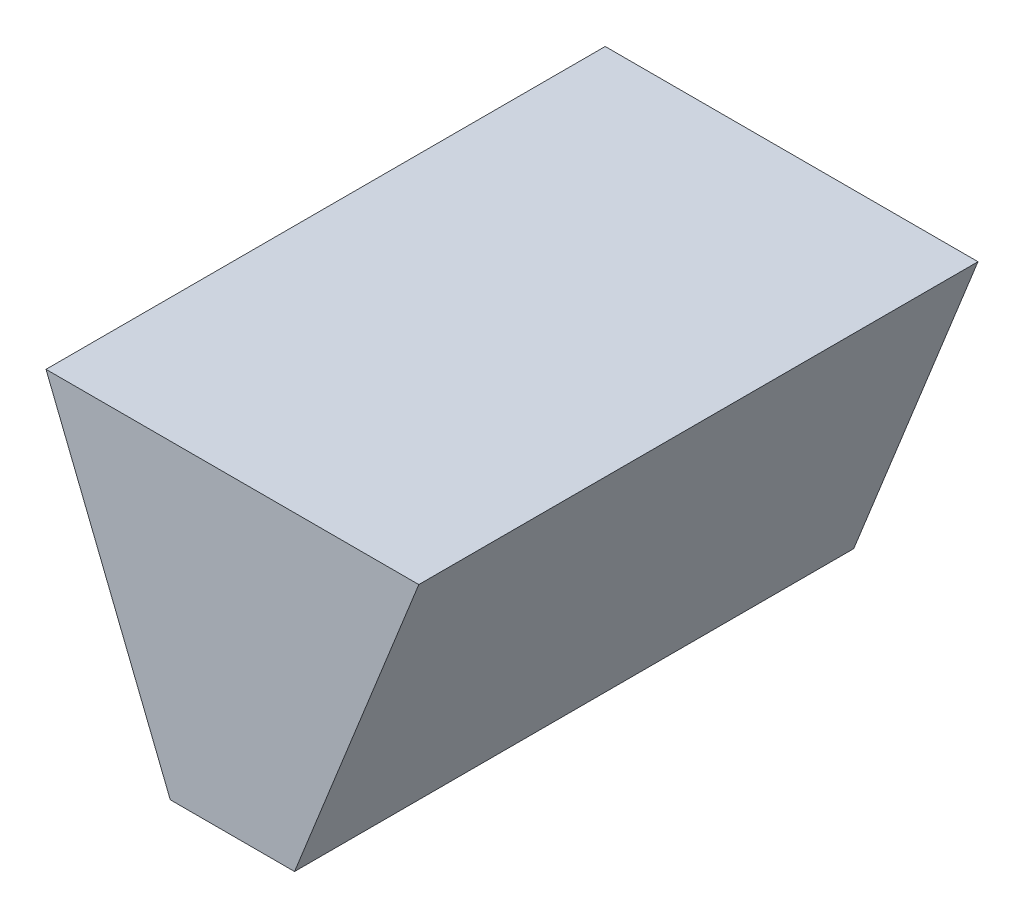
from build123d import *

# Parameters (mm, degrees)
BOSS_EXTRUDE1_DEPTH = 90


with BuildPart() as part:
    # Sketch1 → Boss-Extrude1 (new body)
    with BuildSketch(Plane.XY):
        Polygon((0, 0), (0, 50), (-30, 50), (-10, 0), align=None)
    extrude(amount=BOSS_EXTRUDE1_DEPTH)

    # Mirror1: part across plane


with BuildPart() as part_1:
    add(part.part)
    add(part.part.mirror(Plane(origin=(0, 0, 0), x_dir=(0, 0, 1), z_dir=(1, 0, 0))))


solid = part_1.part
